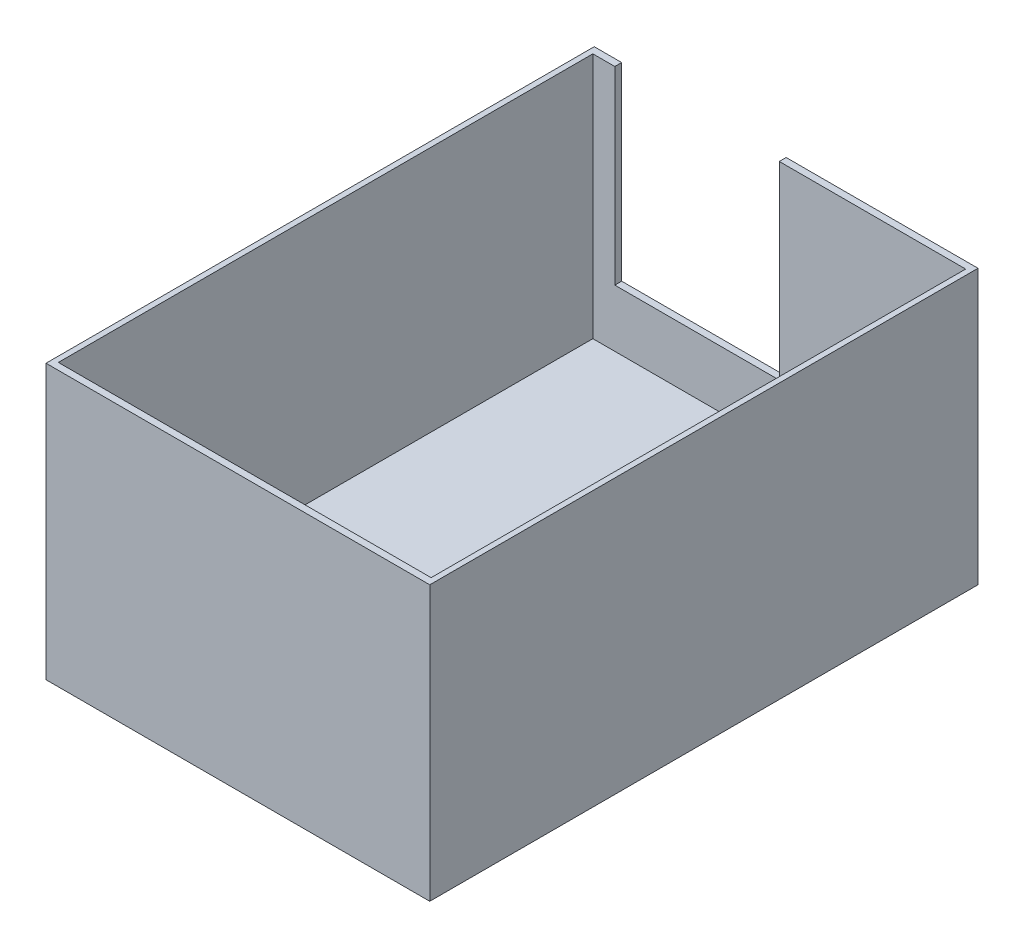
from build123d import *

# Parameters (mm, degrees)
SKETCH1_W           = 70
SKETCH1_H           = 100
BOSS_EXTRUDE1_DEPTH = 50
SKETCH3_W           = 68
SKETCH3_H           = 97.5
CUT_EXTRUDE1_DEPTH  = 45
SKETCH5_W           = 30
SKETCH5_H           = 40
CUT_EXTRUDE2_DEPTH  = 5.5


with BuildPart() as part:
    # Sketch1 → Boss-Extrude1 (new body)
    with BuildSketch(Plane(origin=(0, 0, 0), x_dir=(1, 0, 0), z_dir=(0, 1, 0))):
        Rectangle(SKETCH1_W, SKETCH1_H)
    extrude(amount=BOSS_EXTRUDE1_DEPTH)

    # Sketch3 → Cut-Extrude1 (cut)
    with BuildSketch(Plane(origin=(0, 50, 0), x_dir=(1, 0, 0), z_dir=(0, 1, 0))):
        Rectangle(SKETCH3_W, SKETCH3_H)
    extrude(amount=-CUT_EXTRUDE1_DEPTH, mode=Mode.SUBTRACT)

    # Sketch5 → Cut-Extrude2 (cut)
    with BuildSketch(Plane(origin=(0, 0, -50), x_dir=(-1, 0, 0), z_dir=(0, 0, -1))):
        with Locations((15, 35.461610705)):
            Rectangle(SKETCH5_W, SKETCH5_H)
    extrude(amount=-CUT_EXTRUDE2_DEPTH, mode=Mode.SUBTRACT)


solid = part.part
